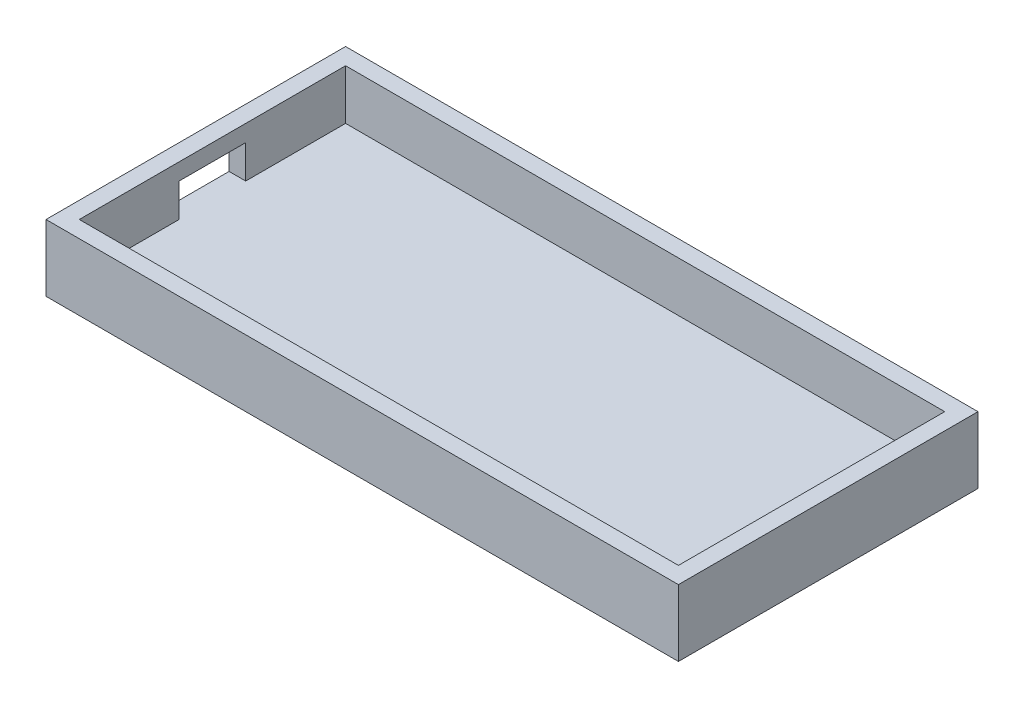
from build123d import *

# Parameters (mm, degrees)
SKETCH3_W           = 190
SKETCH3_H           = 90
BOSS_EXTRUDE2_DEPTH = 20
SKETCH3_4_W         = 180
SKETCH3_4_H         = 80
BOSS_EXTRUDE3_DEPTH = 5
SKETCH4_W           = 20
SKETCH4_H           = 10
CUT_EXTRUDE1_DEPTH  = 5


with BuildPart() as part:
    # Sketch3 → Boss-Extrude2 (new body)
    with BuildSketch(Plane(origin=(0, 0, 0), x_dir=(1, 0, 0), z_dir=(0, 1, 0))):
        Rectangle(SKETCH3_W, SKETCH3_H)
        Polygon((-90, -40), (-90, 5), (-90, 40), (-20, 40), (90, 40), (90, -15), (90, -40), (65, -40), align=None, mode=Mode.SUBTRACT)
    extrude(amount=BOSS_EXTRUDE2_DEPTH)

    # Sketch3<4> → Boss-Extrude3 (add)
    with BuildSketch(Plane(origin=(0, 0, 0), x_dir=(1, 0, 0), z_dir=(0, 1, 0))):
        Rectangle(SKETCH3_4_W, SKETCH3_4_H)
    extrude(amount=BOSS_EXTRUDE3_DEPTH)

    # Sketch4 → Cut-Extrude1 (cut)
    with BuildSketch(Plane.ZY.offset(95)):
        with Locations((0, 10)):
            Rectangle(SKETCH4_W, SKETCH4_H)
    extrude(amount=-CUT_EXTRUDE1_DEPTH, mode=Mode.SUBTRACT)


solid = part.part
